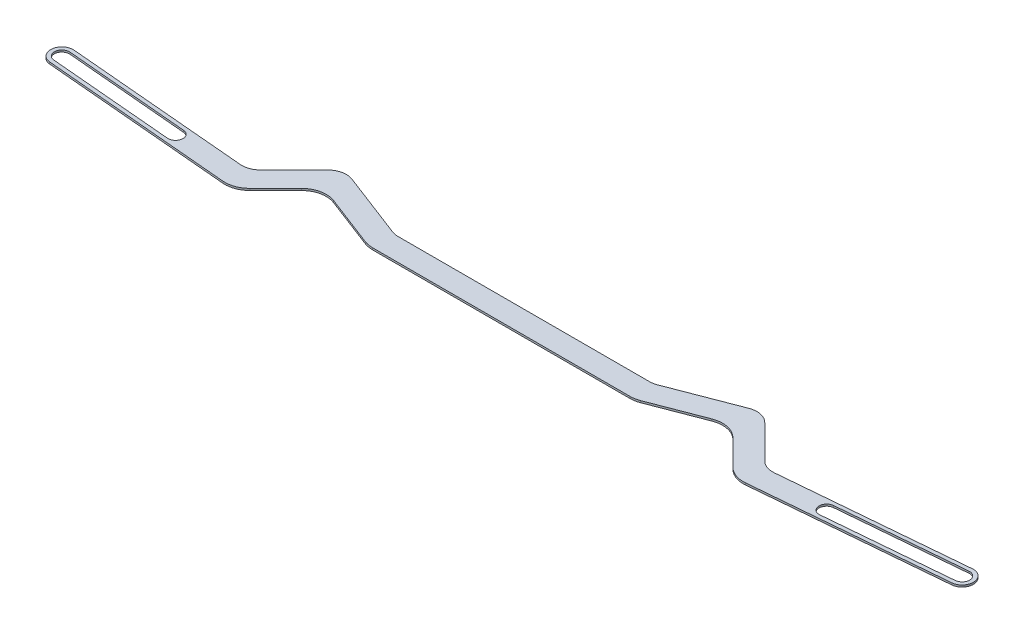
from build123d import *

# Parameters (mm, degrees)
BOSS_EXTRUDE1_DEPTH = 1.5
CUT_EXTRUDE1_DEPTH  = 371.327819887


with BuildPart() as part:
    # Sketch1 → Boss-Extrude1 (new body)
    with BuildSketch(Plane(origin=(0, 0, 0), x_dir=(1, 0, 0), z_dir=(0, 1, 0))):
        with BuildLine():
            Line((105.927382165, 9.996293603), (158.819770869, 30.299779353))
            ThreePointArc((158.819770869, 30.299779353), (167.313965475, 30.968286967), (174.80189183, 26.902674674))
            Line((174.80189183, 26.902674674), (201.609844783, 0.094721721))
            ThreePointArc((201.609844783, 0.094721721), (207.086144351, -3.394065873), (213.523782642, -4.241597033))
            Line((213.523782642, -4.241597033), (359.215598315, 8.504785207))
            ThreePointArc((359.215598315, 8.504785207), (368.965752283, 0.323434609), (360.784401685, -9.426719358))
            Line((360.784401685, -9.426719358), (209.053654194, -22.701439672))
            ThreePointArc((209.053654194, -22.701439672), (200.470136473, -21.571398126), (193.168403715, -16.919681334))
            Line((193.168403715, -16.919681334), (172.635581566, 3.613140816))
            ThreePointArc((172.635581566, 3.613140816), (162.651679758, 9.033957206), (151.326086951, 8.142613722))
            Line((151.326086951, 8.142613722), (110.128629497, -7.67160853))
            ThreePointArc((110.128629497, -7.67160853), (106.605981016, -8.665098151), (102.961270506, -9))
            Line((102.961270506, -9), (0, -9))
            Line((0, -9), (0, 9))
            Line((0, 9), (100.551862922, 9))
            ThreePointArc((100.551862922, 9), (103.285395804, 9.251176387), (105.927382165, 9.996293603))
        make_face()
    extrude(amount=BOSS_EXTRUDE1_DEPTH)

    # Sketch2 → Cut-Extrude1 (cut, through all)
    with BuildSketch(Plane(origin=(0, 1.5, 0), x_dir=(1, 0, 0), z_dir=(0, 1, 0))):
        with BuildLine():
            Line((259.857595734, -3.199373162), (359.477065544, 5.516201113))
            ThreePointArc((359.477065544, 5.516201113), (365.977168189, 0.061967381), (360.522934456, -6.438135264))
            Line((360.522934456, -6.438135264), (260.903464647, -15.153709539))
            ThreePointArc((260.903464647, -15.153709539), (254.403362002, -9.699475807), (259.857595734, -3.199373162))
        make_face()
    extrude(amount=-CUT_EXTRUDE1_DEPTH, mode=Mode.SUBTRACT)

    # Mirror2: part across plane


with BuildPart() as part_1:
    add(part.part)
    add(part.part.mirror(Plane(origin=(0, 0, 0), x_dir=(0, 0, 1), z_dir=(1, 0, 0))))


solid = part_1.part
